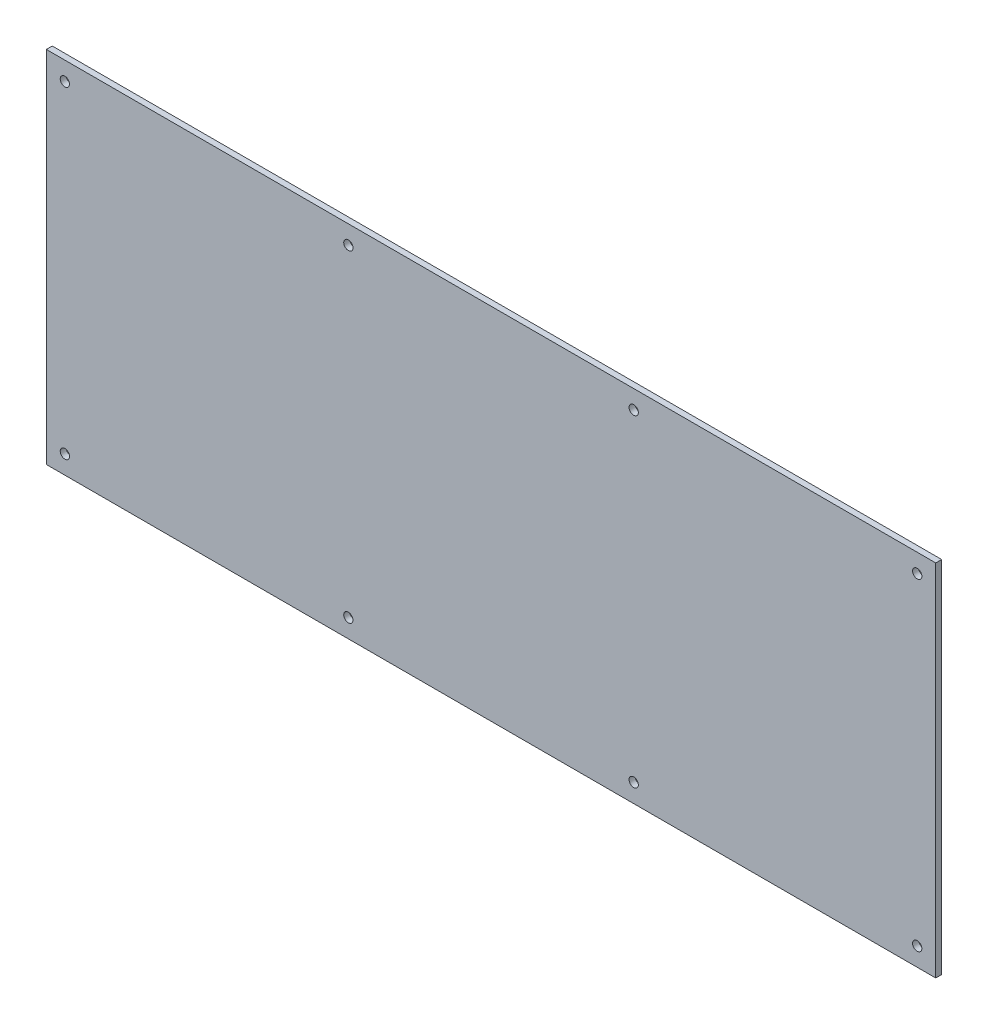
from build123d import *

# Parameters (mm, degrees)
SKETCH1_W          = 304.8
SKETCH1_H          = 123.19
EXTRUDE1_DEPTH     = 2.032
SKETCH2_R          = 1.5875
CUT_EXTRUDE1_DEPTH = 329.75970727


with BuildPart() as part:
    # Sketch1 → Extrude1 (new body)
    with BuildSketch(Plane.XY):
        with Locations((152.4, 61.595)):
            Rectangle(SKETCH1_W, SKETCH1_H)
    extrude(amount=EXTRUDE1_DEPTH)

    # Sketch2 → Cut-Extrude1 (cut, through all)
    with BuildSketch(Plane.XY.offset(2.032)):
        with Locations((6.35, 116.84)):
            Circle(SKETCH2_R)
        with Locations((6.35, 6.35)):
            Circle(SKETCH2_R)
        with Locations((103.505, 6.35)):
            Circle(SKETCH2_R)
        with Locations((103.505, 116.84)):
            Circle(SKETCH2_R)
        with Locations(Location((201.295, 116.84, 0), (0, 0, 180))):
            Circle(SKETCH2_R)
        with Locations(Location((201.295, 6.35, 0), (0, 0, 180))):
            Circle(SKETCH2_R)
        with Locations(Location((298.45, 6.35, 0), (0, 0, 180))):
            Circle(SKETCH2_R)
        with Locations(Location((298.45, 116.84, 0), (0, 0, 180))):
            Circle(SKETCH2_R)
    extrude(amount=-CUT_EXTRUDE1_DEPTH, mode=Mode.SUBTRACT)


solid = part.part
